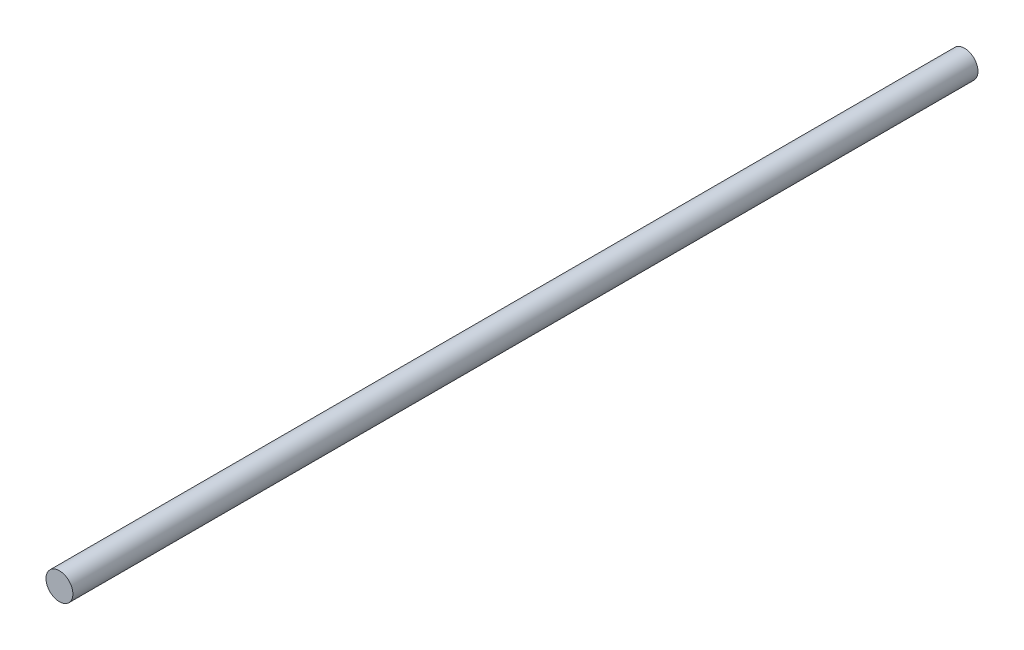
from build123d import *

# Parameters (mm, degrees)
SKETCH1_R           = 8.025
BOSS_EXTRUDE1_DEPTH = 270


with BuildPart() as part:
    # Sketch1 → Boss-Extrude1 (new, symmetric)
    with BuildSketch(Plane.XY):
        Circle(SKETCH1_R)
    extrude(amount=BOSS_EXTRUDE1_DEPTH, both=True)


solid = part.part
